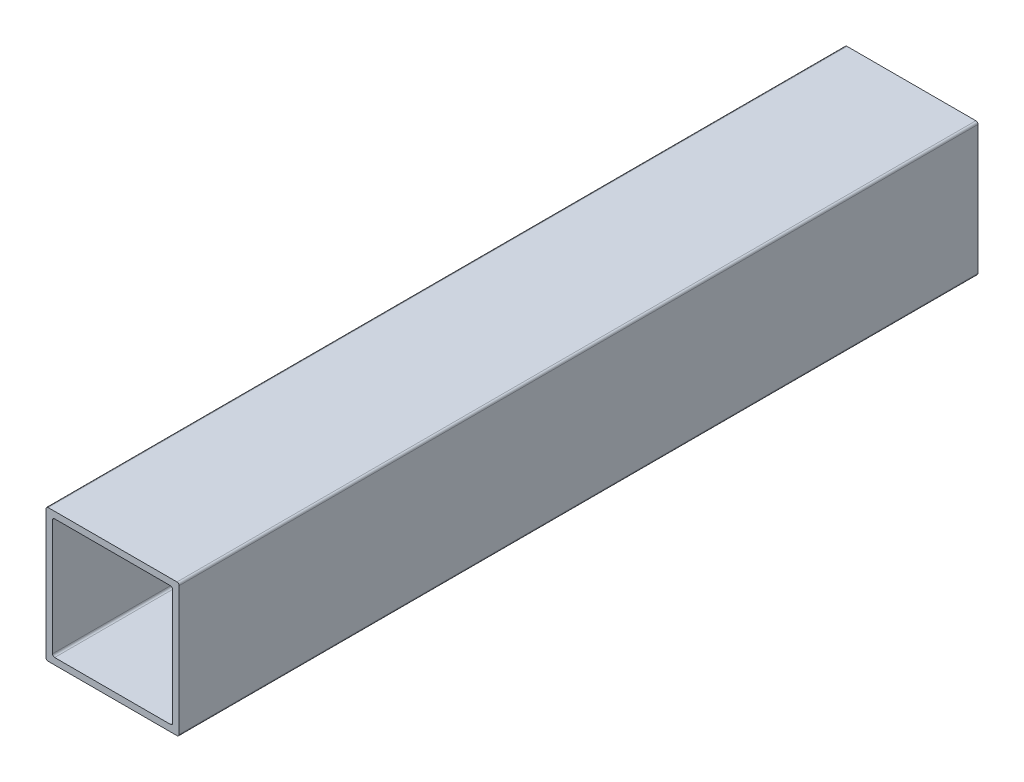
from build123d import *

# Parameters (mm, degrees)
SKETCH1_W           = 25.4
SKETCH1_H           = 25.4
SKETCH1_W_2         = 22.9108
SKETCH1_H_2         = 22.9108
BOSS_EXTRUDE1_DEPTH = 152.4
FILLET1_R           = 0.4064
FILLET2_R           = 0.4064


with BuildPart() as part:
    # Sketch1 → Boss-Extrude1 (new body)
    with BuildSketch(Plane.XY):
        with Locations((12.7, 12.7)):
            Rectangle(SKETCH1_W, SKETCH1_H)
        with Locations((12.7, 12.7)):
            Rectangle(SKETCH1_W_2, SKETCH1_H_2, mode=Mode.SUBTRACT)
    extrude(amount=-BOSS_EXTRUDE1_DEPTH)

    # Fillet1
    fillet1_edges = [part.edges().sort_by_distance(p)[0] for p in [
        (0, 25.4, -76.2),
        (25.4, 25.4, -76.2),
        (25.4, 0, -76.2),
        (0, 0, -76.2),
    ]]
    fillet(fillet1_edges, radius=FILLET1_R)

    # Fillet2
    fillet2_edges = [part.edges().sort_by_distance(p)[0] for p in [
        (1.2446, 1.2446, -76.2),
        (1.2446, 24.1554, -76.2),
        (24.1554, 24.1554, -76.2),
        (24.1554, 1.2446, -76.2),
    ]]
    fillet(fillet2_edges, radius=FILLET2_R)


solid = part.part
